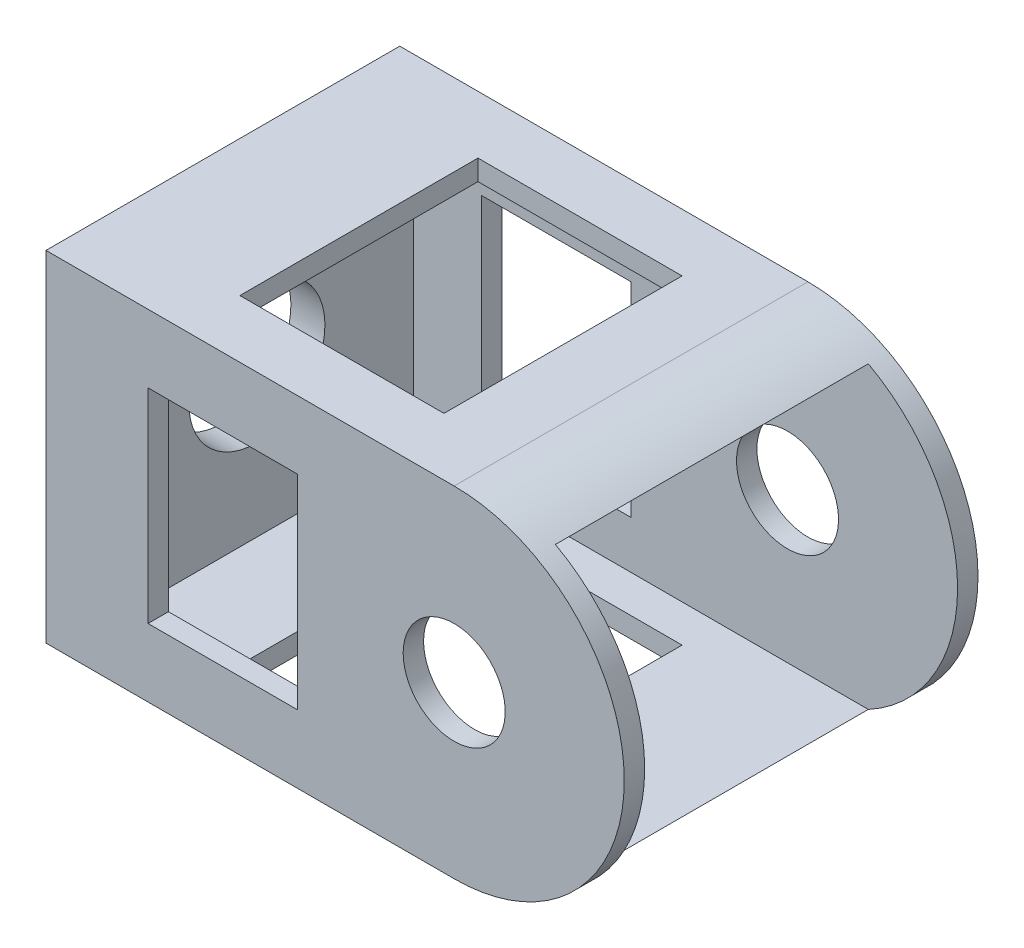
from build123d import *

# Parameters (mm, degrees)
SKETCH_1_R          = 7.5
SKETCH_1_W          = 22
SKETCH_1_H          = 30
EXTRUDE_1_DEPTH     = 52
SKETCH_2_W          = 30
SKETCH_2_H          = 35
CUT_EXTRUDE_1_DEPTH = 108.721864076
SKETCH_3_W          = 46
SKETCH_3_H          = 44
CUT_EXTRUDE_2_DEPTH = 108.721864076
SKETCH_4_W          = 52
SKETCH_4_H          = 50
EXTRUDE_2_DEPTH     = 5
SKETCH_5_R          = 10
CUT_EXTRUDE_3_DEPTH = 112.485425056


with BuildPart() as part:
    # ｽｹｯﾁ1 → ﾎﾞｽ - 押し出し1 (new body)
    with BuildSketch(Plane.XY):
        with BuildLine():
            Line((0, 0), (55, 0))
            ThreePointArc((55, 0), (80, -25), (55, -50))
            Line((55, -50), (0, -50))
            Line((0, -50), (0, 0))
        make_face()
        with Locations(Location((55, -25, 0), (0, 0, 180))):
            Circle(SKETCH_1_R, mode=Mode.SUBTRACT)
        with Locations((21, -25)):
            Rectangle(SKETCH_1_W, SKETCH_1_H, mode=Mode.SUBTRACT)
    extrude(amount=EXTRUDE_1_DEPTH)

    # ｽｹｯﾁ2 → ｶｯﾄ - 押し出し1 (cut, through all)
    with BuildSketch(Plane(origin=(0, 0, 0), x_dir=(1, 0, 0), z_dir=(0, 1, 0))):
        with Locations((30, -26)):
            Rectangle(SKETCH_2_W, SKETCH_2_H)
    extrude(amount=-CUT_EXTRUDE_1_DEPTH, mode=Mode.SUBTRACT)

    # ｽｹｯﾁ3 → ｶｯﾄ - 押し出し2 (cut, through all)
    with BuildSketch(Plane.ZY):
        with Locations((26, -25)):
            Rectangle(SKETCH_3_W, SKETCH_3_H)
    extrude(amount=-CUT_EXTRUDE_2_DEPTH, mode=Mode.SUBTRACT)

    # ｽｹｯﾁ4 → ﾎﾞｽ - 押し出し2 (add)
    with BuildSketch(Plane.ZY):
        with Locations((26, -25)):
            Rectangle(SKETCH_4_W, SKETCH_4_H)
    extrude(amount=EXTRUDE_2_DEPTH)

    # ｽｹｯﾁ5 → ｶｯﾄ - 押し出し3 (cut, through all)
    with BuildSketch(Plane.ZY.offset(5)):
        with Locations(Location((26, -25, 0), (0, 0, 270))):
            Circle(SKETCH_5_R)
    extrude(amount=-CUT_EXTRUDE_3_DEPTH, mode=Mode.SUBTRACT)


solid = part.part
